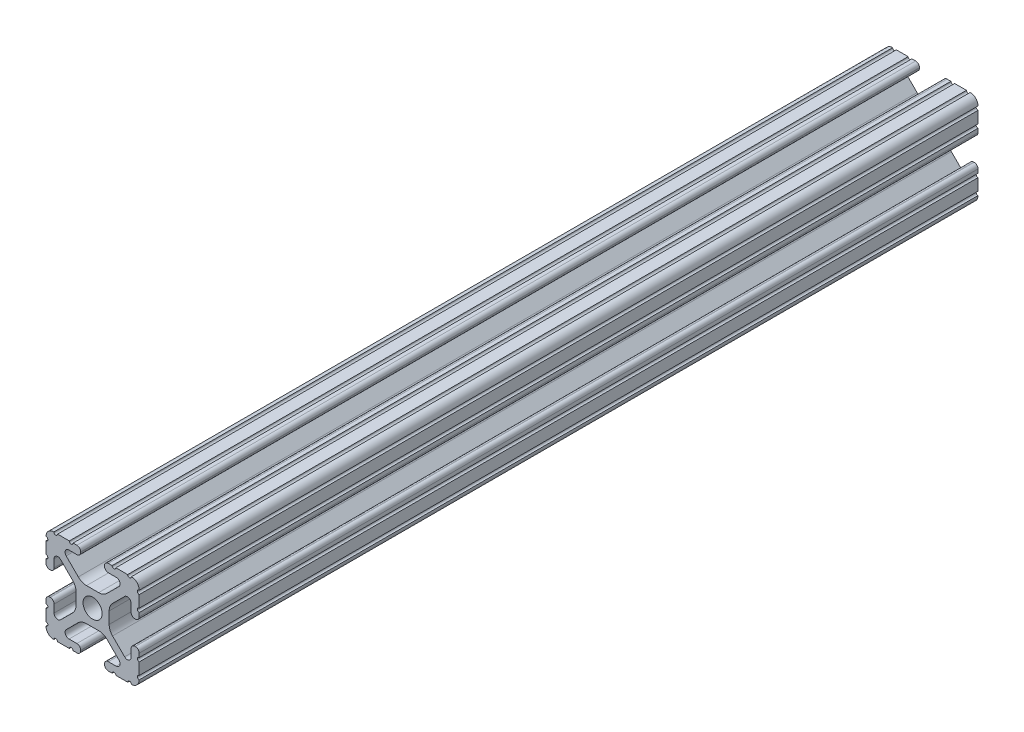
from build123d import *

# Parameters (mm, degrees)
SKETCH1_R           = 2.6035
BOSS_EXTRUDE1_DEPTH = 114.3


with BuildPart() as part:
    # Sketch1 → Boss-Extrude1 (new, symmetric)
    with BuildSketch(Plane.XY):
        with BuildLine():
            Line((-7.179650497, -8.645192506), (-3.952270251, -5.423690499))
            ThreePointArc((-3.952270251, -5.423690499), (-2.922936451, -4.736929036), (-1.709253557, -4.4958))
            Line((-1.709253557, -4.4958), (1.709253557, -4.4958))
            ThreePointArc((1.709253557, -4.4958), (2.922936451, -4.736929036), (3.952270251, -5.423690499))
            Line((3.952270251, -5.423690499), (7.179650497, -8.645192506))
            ThreePointArc((7.179650497, -8.645192506), (7.41473083, -9.822813117), (6.416408329, -10.4902))
            Line((6.416408329, -10.4902), (4.287512407, -10.4902))
            ThreePointArc((4.287512407, -10.4902), (3.54574862, -10.79744862), (3.2385, -11.539212407))
            Line((3.2385, -11.539212407), (3.2385, -11.650987593))
            ThreePointArc((3.2385, -11.650987593), (3.54574862, -12.39275138), (4.287512407, -12.7))
            Line((4.287512407, -12.7), (5.317126718, -12.7))
            ThreePointArc((5.317126718, -12.7), (5.825126718, -12.192), (6.333126718, -12.7))
            Line((6.333126718, -12.7), (9.550443118, -12.7))
            ThreePointArc((9.550443118, -12.7), (10.058366869, -12.192000006), (10.566443095, -12.699847501))
            ThreePointArc((10.566443095, -12.699847501), (12.082537762, -12.08250727), (12.699846982, -10.566399977))
            ThreePointArc((12.699846982, -10.566399977), (12.192000006, -10.058323491), (12.7, -9.5504))
            Line((12.7, -9.5504), (12.7, -6.3330836))
            ThreePointArc((12.7, -6.3330836), (12.192, -5.8250836), (12.7, -5.3170836))
            Line((12.7, -5.3170836), (12.7, -4.287469289))
            ThreePointArc((12.7, -4.287469289), (12.39275138, -3.545705502), (11.650987593, -3.238456882))
            Line((11.650987593, -3.238456882), (11.539212407, -3.238456882))
            ThreePointArc((11.539212407, -3.238456882), (10.79744862, -3.545705502), (10.4902, -4.287469289))
            Line((10.4902, -4.287469289), (10.4902, -6.402089023))
            ThreePointArc((10.4902, -6.402089023), (9.856505071, -7.351067942), (8.737131347, -7.129408934))
            Line((8.737131347, -7.129408934), (5.441005833, -3.840816462))
            ThreePointArc((5.441005833, -3.840816462), (4.750877967, -2.809883091), (4.5085, -1.593185507))
            Line((4.5085, -1.593185507), (4.5085, 1.593185507))
            ThreePointArc((4.5085, 1.593185507), (4.750877967, 2.809883091), (5.441005833, 3.840816462))
            Line((5.441005833, 3.840816462), (8.737131347, 7.129408934))
            ThreePointArc((8.737131347, 7.129408934), (9.856505071, 7.351067942), (10.4902, 6.402089023))
            Line((10.4902, 6.402089023), (10.4902, 4.287469289))
            ThreePointArc((10.4902, 4.287469289), (10.79744862, 3.545705502), (11.539212407, 3.238456882))
            Line((11.539212407, 3.238456882), (11.650987593, 3.238456882))
            ThreePointArc((11.650987593, 3.238456882), (12.39275138, 3.545705502), (12.7, 4.287469289))
            Line((12.7, 4.287469289), (12.7, 5.3170836))
            ThreePointArc((12.7, 5.3170836), (12.192, 5.8250836), (12.7, 6.3330836))
            Line((12.7, 6.3330836), (12.7, 9.5504))
            ThreePointArc((12.7, 9.5504), (12.192000006, 10.058323491), (12.699846982, 10.566399977))
            ThreePointArc((12.699846982, 10.566399977), (12.082537762, 12.08250727), (10.566443095, 12.699847501))
            ThreePointArc((10.566443095, 12.699847501), (10.058366869, 12.192000006), (9.550443118, 12.7))
            Line((9.550443118, 12.7), (6.333126718, 12.7))
            ThreePointArc((6.333126718, 12.7), (5.825126718, 12.192), (5.317126718, 12.7))
            Line((5.317126718, 12.7), (4.287512407, 12.7))
            ThreePointArc((4.287512407, 12.7), (3.54574862, 12.39275138), (3.2385, 11.650987593))
            Line((3.2385, 11.650987593), (3.2385, 11.539212407))
            ThreePointArc((3.2385, 11.539212407), (3.54574862, 10.79744862), (4.287512407, 10.4902))
            Line((4.287512407, 10.4902), (6.476788598, 10.4902))
            ThreePointArc((6.476788598, 10.4902), (7.432222385, 9.85140422), (7.207036008, 8.724370562))
            Line((7.207036008, 8.724370562), (3.898272566, 5.423169045))
            ThreePointArc((3.898272566, 5.423169045), (2.869120213, 4.736787962), (1.655778399, 4.4958))
            Line((1.655778399, 4.4958), (-1.655778399, 4.4958))
            ThreePointArc((-1.655778399, 4.4958), (-2.869120213, 4.736787962), (-3.898272566, 5.423169045))
            Line((-3.898272566, 5.423169045), (-7.207036008, 8.724370562))
            ThreePointArc((-7.207036008, 8.724370562), (-7.432222385, 9.85140422), (-6.476788598, 10.4902))
            Line((-6.476788598, 10.4902), (-4.287512407, 10.4902))
            ThreePointArc((-4.287512407, 10.4902), (-3.54574862, 10.79744862), (-3.2385, 11.539212407))
            Line((-3.2385, 11.539212407), (-3.2385, 11.650987593))
            ThreePointArc((-3.2385, 11.650987593), (-3.54574862, 12.39275138), (-4.287512407, 12.7))
            Line((-4.287512407, 12.7), (-5.317126718, 12.7))
            ThreePointArc((-5.317126718, 12.7), (-5.825126718, 12.192), (-6.333126718, 12.7))
            Line((-6.333126718, 12.7), (-9.550443118, 12.7))
            ThreePointArc((-9.550443118, 12.7), (-10.058366869, 12.192000006), (-10.566443095, 12.699847501))
            ThreePointArc((-10.566443095, 12.699847501), (-12.082537762, 12.08250727), (-12.699846982, 10.566399977))
            ThreePointArc((-12.699846982, 10.566399977), (-12.192000006, 10.058323491), (-12.7, 9.5504))
            Line((-12.7, 9.5504), (-12.7, 6.3330836))
            ThreePointArc((-12.7, 6.3330836), (-12.192, 5.8250836), (-12.7, 5.3170836))
            Line((-12.7, 5.3170836), (-12.7, 4.287469289))
            ThreePointArc((-12.7, 4.287469289), (-12.39275138, 3.545705502), (-11.650987593, 3.238456882))
            Line((-11.650987593, 3.238456882), (-11.539212407, 3.238456882))
            ThreePointArc((-11.539212407, 3.238456882), (-10.79744862, 3.545705502), (-10.4902, 4.287469289))
            Line((-10.4902, 4.287469289), (-10.4902, 6.402089023))
            ThreePointArc((-10.4902, 6.402089023), (-9.856505071, 7.351067942), (-8.737131347, 7.129408934))
            Line((-8.737131347, 7.129408934), (-5.441005833, 3.840816462))
            ThreePointArc((-5.441005833, 3.840816462), (-4.750877967, 2.809883091), (-4.5085, 1.593185507))
            Line((-4.5085, 1.593185507), (-4.5085, -1.593185507))
            ThreePointArc((-4.5085, -1.593185507), (-4.750877967, -2.809883091), (-5.441005833, -3.840816462))
            Line((-5.441005833, -3.840816462), (-8.737131347, -7.129408934))
            ThreePointArc((-8.737131347, -7.129408934), (-9.856505071, -7.351067942), (-10.4902, -6.402089023))
            Line((-10.4902, -6.402089023), (-10.4902, -4.287469289))
            ThreePointArc((-10.4902, -4.287469289), (-10.79744862, -3.545705502), (-11.539212407, -3.238456882))
            Line((-11.539212407, -3.238456882), (-11.650987593, -3.238456882))
            ThreePointArc((-11.650987593, -3.238456882), (-12.39275138, -3.545705502), (-12.7, -4.287469289))
            Line((-12.7, -4.287469289), (-12.7, -5.3170836))
            ThreePointArc((-12.7, -5.3170836), (-12.192, -5.8250836), (-12.7, -6.3330836))
            Line((-12.7, -6.3330836), (-12.7, -9.5504))
            ThreePointArc((-12.7, -9.5504), (-12.192000006, -10.058323491), (-12.699846982, -10.566399977))
            ThreePointArc((-12.699846982, -10.566399977), (-12.082537762, -12.08250727), (-10.566443095, -12.699847501))
            ThreePointArc((-10.566443095, -12.699847501), (-10.058366869, -12.192000006), (-9.550443118, -12.7))
            Line((-9.550443118, -12.7), (-6.333126718, -12.7))
            ThreePointArc((-6.333126718, -12.7), (-5.825126718, -12.192), (-5.317126718, -12.7))
            Line((-5.317126718, -12.7), (-4.287512407, -12.7))
            ThreePointArc((-4.287512407, -12.7), (-3.54574862, -12.39275138), (-3.2385, -11.650987593))
            Line((-3.2385, -11.650987593), (-3.2385, -11.539212407))
            ThreePointArc((-3.2385, -11.539212407), (-3.54574862, -10.79744862), (-4.287512407, -10.4902))
            Line((-4.287512407, -10.4902), (-6.416408329, -10.4902))
            ThreePointArc((-6.416408329, -10.4902), (-7.41473083, -9.822813117), (-7.179650497, -8.645192506))
        make_face()
        Circle(SKETCH1_R, mode=Mode.SUBTRACT)
    extrude(amount=BOSS_EXTRUDE1_DEPTH, both=True)


solid = part.part
